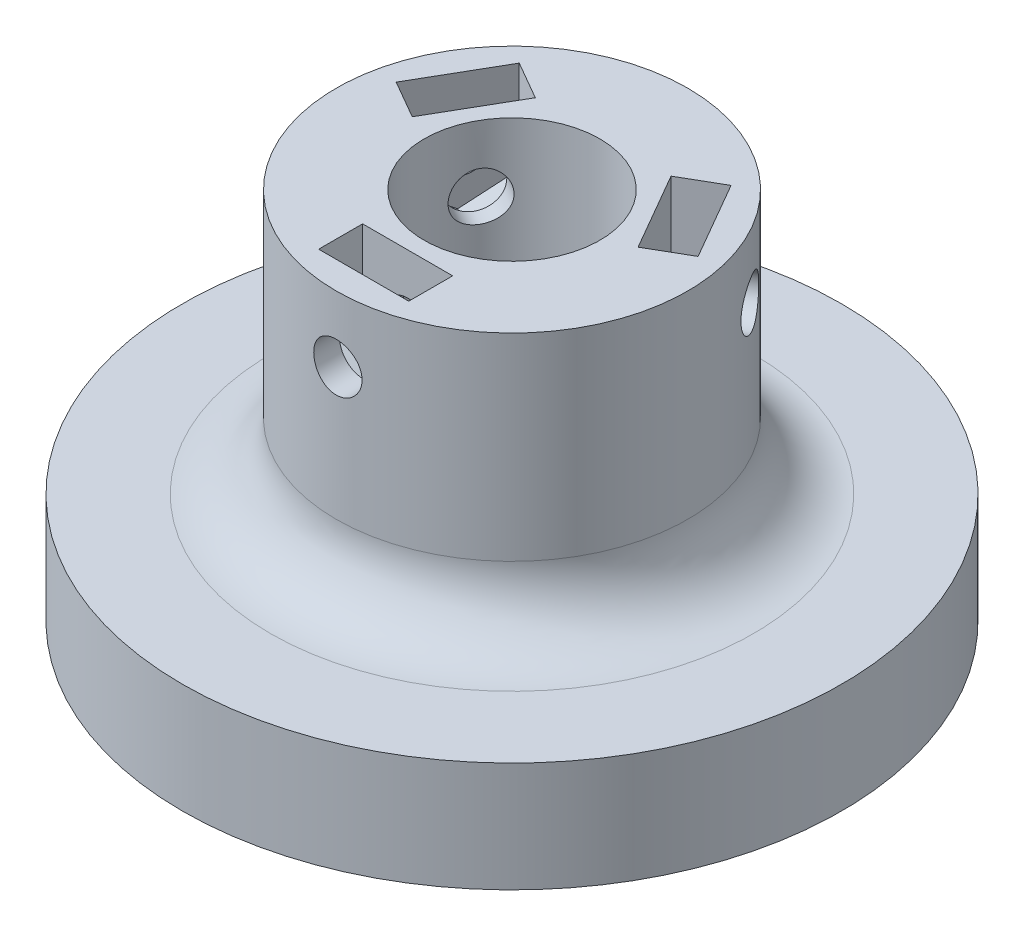
from build123d import *

# Parameters (mm, degrees)
SKETCH4_W          = 1.1
SKETCH4_H          = 20.490381057
CUT_EXTRUDE1_START = -1.25
CUT_EXTRUDE1_DEPTH = 2
CIRPATTERN1_COUNT  = 3
FILLET1_R          = 3


with BuildPart() as part:
    # Sketch1 → Revolve1 (revolve)
    with BuildSketch(Plane.XY, mode=Mode.PRIVATE) as revolve1_sk:
        Polygon((0, 0), (15, 0), (15, 5), (8, 5), (8, 17), (4, 17), (4, 5), (0, 5), align=None)
    revolve(revolve1_sk.sketch.rotate(Axis((0, 0, 0), (0, 1, 0)), 90), axis=Axis((0, 0, 0), (0, 1, 0)))

    # Sketch4 → M2 Clearance Hole1 (revolve, cut)
    with BuildSketch(Plane(origin=(0, 14, 0), x_dir=(0, 1, 0), z_dir=(1, 0, 0))):
        with Locations((0.55, 10.245190529)):
            Rectangle(SKETCH4_W, SKETCH4_H)
    m2_clearance_hole1 = revolve(axis=Axis((0, 14, -6.35), (0, 0, 1)), mode=Mode.SUBTRACT)

    # Sketch5 → Cut-Extrude1 (cut)
    with BuildSketch(Plane.XY.offset(8).offset(CUT_EXTRUDE1_START)):
        Polygon((2.05, 17), (2.05, 15.183568052), (0, 16.367136104), (-2.05, 15.183568052), (-2.05, 17), align=None)
        Polygon((0, 11.632863896), (2.05, 12.816431948), (2.05, 15.183568052), (0, 16.367136104), (-2.05, 15.183568052), (-2.05, 12.816431948), align=None)
    cut_extrude1 = extrude(amount=-CUT_EXTRUDE1_DEPTH, mode=Mode.SUBTRACT)

    # CirPattern1: M2 Clearance Hole1, Cut-Extrude1 ×3 about axis
    cirpattern1_axis = Axis((0, 0, 0), (0, 1, 0))
    add([m2_clearance_hole1.rotate(cirpattern1_axis, i * 360 / CIRPATTERN1_COUNT) for i in range(1, CIRPATTERN1_COUNT)], mode=Mode.SUBTRACT)
    add([cut_extrude1.rotate(cirpattern1_axis, i * 360 / CIRPATTERN1_COUNT) for i in range(1, CIRPATTERN1_COUNT)], mode=Mode.SUBTRACT)

    # Fillet1
    fillet1_edges = [part.edges().sort_by_distance(p)[0] for p in [
        (0, 5, 8),
    ]]
    fillet(fillet1_edges, radius=FILLET1_R)


solid = part.part
